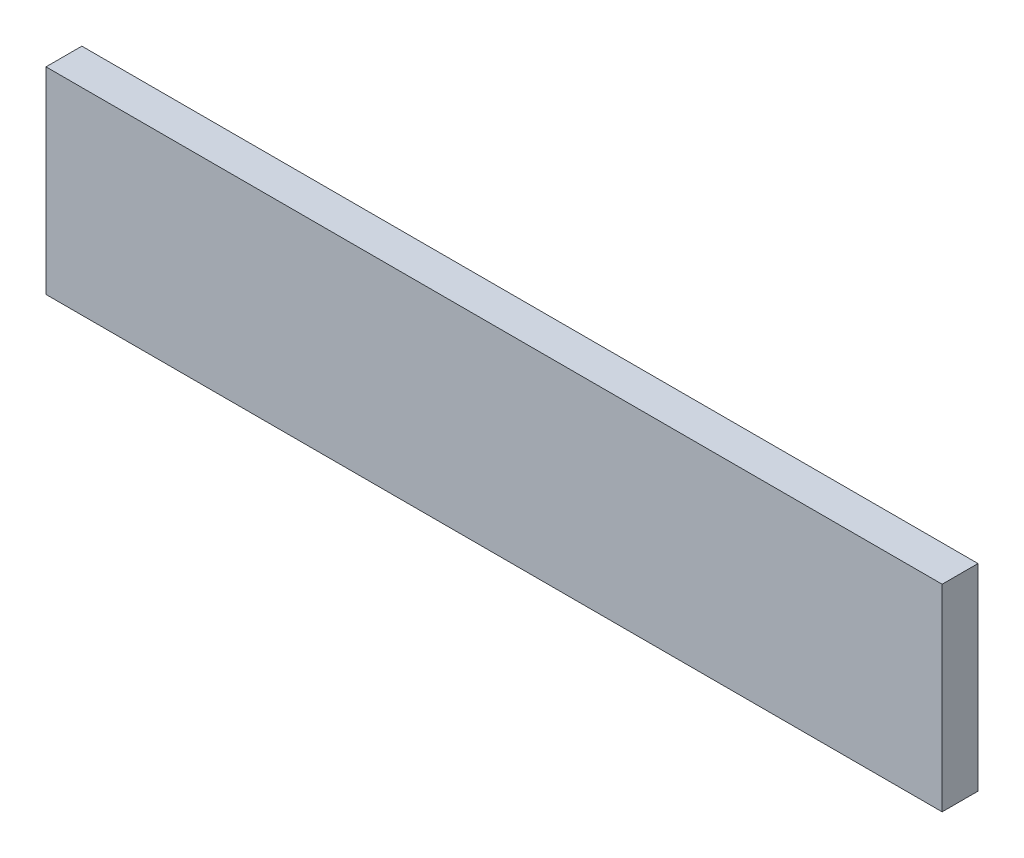
from build123d import *

# Parameters (mm, degrees)
SKETCH1_W           = 250
SKETCH1_H           = 55
BOSS_EXTRUDE1_DEPTH = 10


with BuildPart() as part:
    # Sketch1 → Boss-Extrude1 (new body)
    with BuildSketch(Plane.XY):
        Rectangle(SKETCH1_W, SKETCH1_H)
    extrude(amount=BOSS_EXTRUDE1_DEPTH)


solid = part.part
